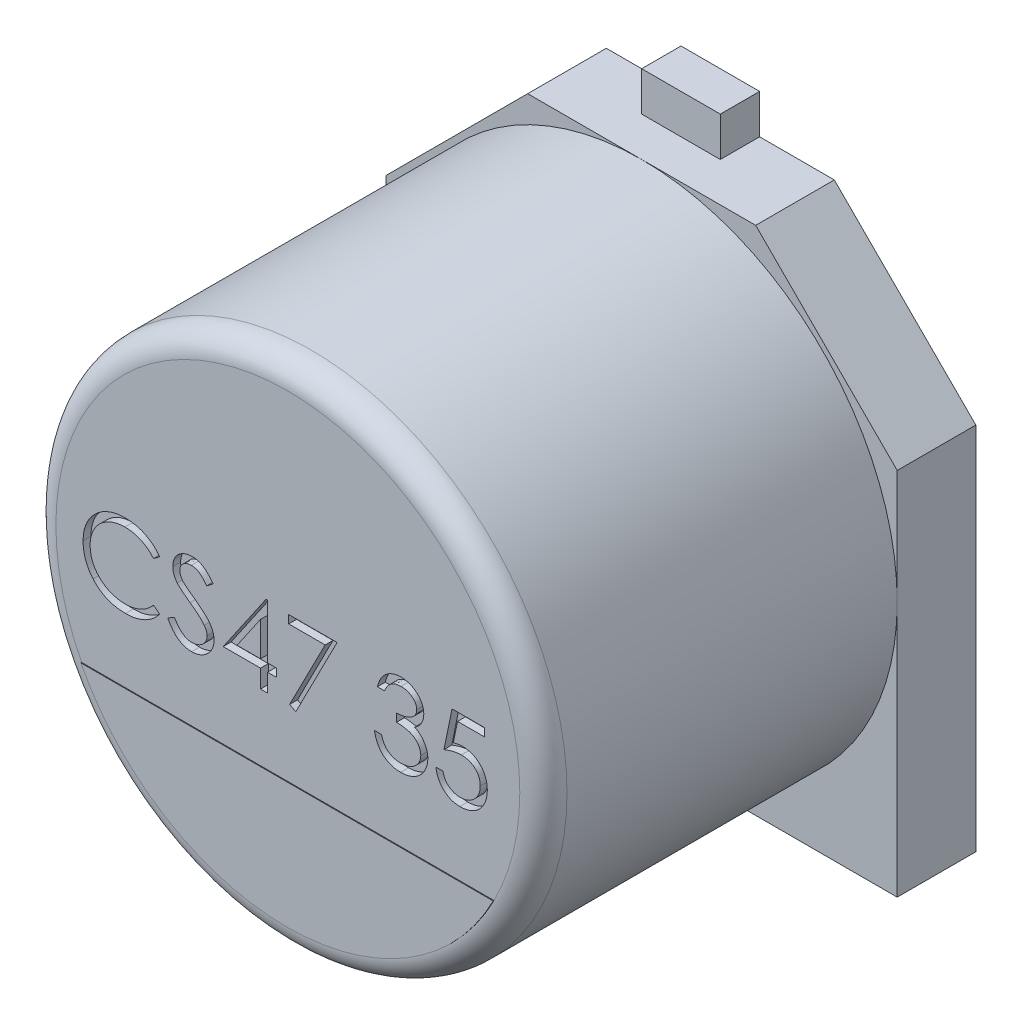
from build123d import *

# Parameters (mm, degrees)
SKETCH1_W                = 6.5
SKETCH1_H                = 6.5
BOSS_EXTRUDE1_DEPTH      = 1
SKETCH2_R                = 3.25
BOSS_EXTRUDE2_DEPTH      = 4.5
CHAMFER1_SIZE            = 1.8
FILLET1_R                = 0.3
BOSS_EXTRUDE3_DEPTH      = 0.01
BOSS_EXTRUDE4_DEPTH      = 0.5
BOSS_EXTRUDE4_DEPTH_BACK = 0.5
SKETCH4_W                = 0.5
SKETCH4_H                = 0.5
CUT_EXTRUDE1_DEPTH       = 0.1


with BuildPart() as part:
    # Sketch1 → Boss-Extrude1 (new body)
    with BuildSketch(Plane.XY):
        Rectangle(SKETCH1_W, SKETCH1_H)
    extrude(amount=BOSS_EXTRUDE1_DEPTH)

    # Sketch2 → Boss-Extrude2 (add)
    with BuildSketch(Plane.XY.offset(1)):
        Circle(SKETCH2_R)
    extrude(amount=BOSS_EXTRUDE2_DEPTH)

    # Chamfer1
    chamfer1_edges = [part.edges().sort_by_distance(p)[0] for p in [
        (-3.25, 3.25, 0.5),
        (3.25, 3.25, 0.5),
    ]]
    chamfer(chamfer1_edges, length=CHAMFER1_SIZE)

    # Fillet1
    fillet1_edges = [part.edges().sort_by_distance(p)[0] for p in [
        (-3.25, 0, 5.5),
    ]]
    fillet(fillet1_edges, radius=FILLET1_R)

    # Sketch3 → Boss-Extrude3 (add)
    with BuildSketch(Plane.XY.offset(5.5)):
        with BuildLine():
            Line((-2.622532588, -1.350860032), (2.622532588, -1.350860032))
            ThreePointArc((2.622532588, -1.350860032), (0, -2.95), (-2.622532588, -1.350860032))
        make_face()
    extrude(amount=BOSS_EXTRUDE3_DEPTH)

    # Sketch4 → Boss-Extrude4 (add, two sides: drawn at the far end of the back side and taken through both)
    with BuildSketch(Plane(origin=(0, 0, 0), x_dir=(0, 0, -1), z_dir=(1, 0, 0)).offset(-BOSS_EXTRUDE4_DEPTH_BACK)):
        with Locations((-0.25, 3.5)):
            Rectangle(SKETCH4_W, SKETCH4_H)
        with Locations((-0.25, -3.5)):
            Rectangle(SKETCH4_W, SKETCH4_H)
    extrude(amount=BOSS_EXTRUDE4_DEPTH + BOSS_EXTRUDE4_DEPTH_BACK)

    # Sketch5 → Cut-Extrude1 (cut)
    # profile 1 of 6: a face of its own
    with BuildSketch(Plane.XY.offset(5.5)):
        with BuildLine():
            Line((-1.630083449, 0.309662932), (-1.70860909, 0.249566778))
            add(Edge.make_bspline(
                [(-1.70860909, 0.249566778), (-1.714210772, 0.256242769), (-1.725338614, 0.269504745), (-1.743241244, 0.288127472), (-1.761898856, 0.30557469), (-1.781304319, 0.321929512), (-1.801806925, 0.336620017), (-1.82291001, 0.35041176), (-1.844966594, 0.362773971), (-1.87546709, 0.377763396), (-1.915366475, 0.393405154), (-1.965593572, 0.406520363), (-2.018025315, 0.414869271), (-2.053796057, 0.415773511), (-2.0719905, 0.416233444)],
                knots=[0, 0, 0, 0, 0.757959112, 1.505699292, 2.245454638, 2.979532153, 3.711538275, 4.438200793, 5.171680507, 5.909471876, 7.393775596, 8.890124382, 10.418191784, 12, 12, 12, 12], degree=3))
            add(Edge.make_bspline(
                [(-2.0719905, 0.416233444), (-2.0820143, 0.416118026), (-2.101968869, 0.415888262), (-2.131582719, 0.412857083), (-2.160643591, 0.408596738), (-2.189132581, 0.402275217), (-2.217013426, 0.39428304), (-2.244468398, 0.384732922), (-2.271099998, 0.372917253), (-2.297276638, 0.35985775), (-2.322356412, 0.345107052), (-2.346086426, 0.329017523), (-2.368380131, 0.311769209), (-2.389255163, 0.293297465), (-2.408732863, 0.273685476), (-2.426672094, 0.252724235), (-2.443010783, 0.230480757), (-2.45807279, 0.207248355), (-2.471562143, 0.1830947), (-2.482856394, 0.157930395), (-2.492857857, 0.132186365), (-2.500771927, 0.105571748), (-2.507036074, 0.078273815), (-2.511358264, 0.050219304), (-2.51435497, 0.021466824), (-2.514583592, 0.001978449), (-2.514698834, -0.007845081)],
                knots=[0, 0, 0, 0, 1.054917814, 2.100044995, 3.131103042, 4.146048494, 5.169673617, 6.183595914, 7.203665975, 8.234915748, 9.262203917, 10.264457458, 11.251630812, 12.227803204, 13.197192746, 14.159520551, 15.12972552, 16.100847026, 17.073214652, 18.039054194, 19.002613845, 19.979014051, 20.95965708, 21.949030935, 22.966165397, 24, 24, 24, 24], degree=3))
            add(Edge.make_bspline(
                [(-2.514698834, -0.007845081), (-2.514338314, -0.022625458), (-2.513630481, -0.051644768), (-2.507330957, -0.094150657), (-2.497758074, -0.13487085), (-2.483410766, -0.173550805), (-2.465719609, -0.210667478), (-2.443365149, -0.245592865), (-2.417474709, -0.278854741), (-2.387682018, -0.309667011), (-2.354994642, -0.33781379), (-2.31992381, -0.36259967), (-2.282556871, -0.383261065), (-2.243306405, -0.400454193), (-2.201870373, -0.413670401), (-2.158323286, -0.422974436), (-2.112759859, -0.429043631), (-2.081625745, -0.429624684), (-2.065780564, -0.429920402)],
                knots=[0, 0, 0, 0, 1.029171465, 2.020641659, 2.987623507, 3.938342917, 4.889210282, 5.84687017, 6.821220943, 7.821438502, 8.827599549, 9.822697543, 10.807740252, 11.797342354, 12.80366471, 13.83203677, 14.896651826, 16, 16, 16, 16], degree=3))
            add(Edge.make_bspline(
                [(-2.065780564, -0.429920402), (-2.048322653, -0.429437893), (-2.013961308, -0.428488201), (-1.963570443, -0.420442701), (-1.915331653, -0.407397582), (-1.869242343, -0.389141033), (-1.825432444, -0.365408093), (-1.783833398, -0.336637271), (-1.744410092, -0.30255489), (-1.720704011, -0.27653114), (-1.70860909, -0.263253735)],
                knots=[0, 0, 0, 0, 1.028121516, 2.023589091, 2.998037872, 3.967518031, 4.937445131, 5.927275754, 6.942489185, 8, 8, 8, 8], degree=3))
            Line((-1.70860909, -0.263253735), (-1.630083449, -0.322748927))
            add(Edge.make_bspline(
                [(-1.630083449, -0.322748927), (-1.636402909, -0.330902771), (-1.649011559, -0.347171401), (-1.669428135, -0.370106175), (-1.690935935, -0.391678757), (-1.713694709, -0.41171522), (-1.737442649, -0.430616496), (-1.762606167, -0.447845591), (-1.788854462, -0.463642986), (-1.816098599, -0.478107822), (-1.844309631, -0.490941321), (-1.873453756, -0.501928112), (-1.903405349, -0.511392366), (-1.93416578, -0.519178634), (-1.965798853, -0.525256086), (-1.998190417, -0.52931885), (-2.031410381, -0.532102254), (-2.053822216, -0.532355945), (-2.065179603, -0.532484504)],
                knots=[0, 0, 0, 0, 0.986787822, 1.968848986, 2.935600012, 3.899624008, 4.868462664, 5.837806735, 6.815139263, 7.798259679, 8.787526145, 9.778297419, 10.776456485, 11.791383307, 12.812564526, 13.85620153, 14.913611965, 16, 16, 16, 16], degree=3))
            add(Edge.make_bspline(
                [(-2.065179603, -0.532484504), (-2.075934936, -0.532409649), (-2.097202276, -0.532261633), (-2.12860192, -0.529863871), (-2.159170371, -0.526592517), (-2.188820264, -0.521666766), (-2.2177134, -0.515854097), (-2.245587853, -0.508062309), (-2.272717913, -0.499333976), (-2.298994582, -0.489075408), (-2.32444021, -0.477499356), (-2.348972728, -0.464416054), (-2.372580851, -0.449935521), (-2.395496686, -0.434376947), (-2.41738171, -0.417240575), (-2.438425574, -0.398764393), (-2.458746282, -0.379010676), (-2.471318477, -0.364766432), (-2.477639539, -0.357604697)],
                knots=[0, 0, 0, 0, 1.114604814, 2.203992996, 3.262667896, 4.300477797, 5.318619304, 6.316056647, 7.298880507, 8.271930387, 9.238335007, 10.195173496, 11.151986948, 12.108099108, 13.064862484, 14.031167946, 15.010108607, 16, 16, 16, 16], degree=3))
            add(Edge.make_bspline(
                [(-2.477639539, -0.357604697), (-2.487764008, -0.345164357), (-2.507890716, -0.320433868), (-2.533640911, -0.280352159), (-2.55568307, -0.2385041), (-2.573504762, -0.194669834), (-2.587436971, -0.148947724), (-2.597088741, -0.10131472), (-2.603360628, -0.051815308), (-2.604077853, -0.018147654), (-2.604442423, -0.001034184)],
                knots=[0, 0, 0, 0, 0.994628077, 1.977248131, 2.950237994, 3.925870899, 4.908910175, 5.911660606, 6.938484602, 8, 8, 8, 8], degree=3))
            add(Edge.make_bspline(
                [(-2.604442423, -0.001034184), (-2.603998082, 0.016953089), (-2.603123869, 0.052341924), (-2.595696499, 0.104277339), (-2.583748272, 0.154034882), (-2.566777732, 0.201521666), (-2.545261917, 0.24698746), (-2.518682885, 0.290084948), (-2.487349416, 0.331089747), (-2.451507253, 0.369379676), (-2.4122023, 0.40439092), (-2.370111211, 0.435192693), (-2.325316369, 0.460826269), (-2.278311268, 0.482253743), (-2.228743931, 0.49872359), (-2.176720111, 0.510253072), (-2.122337564, 0.517429391), (-2.085234014, 0.518336593), (-2.066381526, 0.518797547)],
                knots=[0, 0, 0, 0, 1.032925535, 2.032216505, 3.007276963, 3.968222605, 4.92396291, 5.891752235, 6.871517503, 7.883894988, 8.900124299, 9.891468569, 10.874487609, 11.85992873, 12.854644235, 13.869047385, 14.917252991, 16, 16, 16, 16], degree=3))
            add(Edge.make_bspline(
                [(-2.066381526, 0.518797547), (-2.054891677, 0.518659793), (-2.032148678, 0.518387123), (-1.998505063, 0.515728226), (-1.965750112, 0.511295767), (-1.93386126, 0.505262604), (-1.90268337, 0.497774798), (-1.872454729, 0.488020427), (-1.842997962, 0.476867132), (-1.814498845, 0.464021856), (-1.787094117, 0.449602787), (-1.760792311, 0.433769752), (-1.735802352, 0.416542379), (-1.711948395, 0.398067186), (-1.689629478, 0.377953312), (-1.668211912, 0.356753999), (-1.648423033, 0.33385862), (-1.636207834, 0.317742925), (-1.630083449, 0.309662932)],
                knots=[0, 0, 0, 0, 1.096760587, 2.17092713, 3.219439832, 4.250915756, 5.268269357, 6.278326846, 7.281116186, 8.274029601, 9.260640565, 10.235837813, 11.203064059, 12.156899882, 13.114053108, 14.069676657, 15.032185724, 16, 16, 16, 16], degree=3))
        make_face()
    # profile 2 of 6: a face of its own
    with BuildSketch(Plane.XY.offset(5.5)):
        with BuildLine():
            Line((-1.527519347, -0.313934825), (-1.44298409, -0.263253735))
            add(Edge.make_bspline(
                [(-1.44298409, -0.263253735), (-1.435121737, -0.276414988), (-1.420057771, -0.301631441), (-1.394928811, -0.335705166), (-1.368890836, -0.364665783), (-1.341751027, -0.388344813), (-1.313675042, -0.406987352), (-1.284479598, -0.42018799), (-1.25426308, -0.428421126), (-1.233699131, -0.429421151), (-1.223432808, -0.429920402)],
                knots=[0, 0, 0, 0, 1.272034388, 2.437168799, 3.508375237, 4.49857839, 5.41946034, 6.295179144, 7.148887113, 8, 8, 8, 8], degree=3))
            add(Edge.make_bspline(
                [(-1.223432808, -0.429920402), (-1.214665134, -0.42967621), (-1.197283198, -0.429192098), (-1.171693986, -0.42454044), (-1.146842043, -0.417394118), (-1.123239575, -0.407159566), (-1.101212256, -0.394777142), (-1.081896058, -0.379821091), (-1.065197168, -0.363076461), (-1.051537421, -0.344395702), (-1.041057411, -0.324305088), (-1.033002534, -0.303683388), (-1.028532513, -0.282206654), (-1.027859155, -0.267746522), (-1.027519347, -0.260449248)],
                knots=[0, 0, 0, 0, 1.095163259, 2.171163733, 3.241058638, 4.321873601, 5.38011039, 6.391990106, 7.366004449, 8.327778327, 9.272591725, 10.192022065, 11.087607919, 12, 12, 12, 12], degree=3))
            add(Edge.make_bspline(
                [(-1.027519347, -0.260449248), (-1.027940578, -0.252123291), (-1.02879688, -0.235197837), (-1.036034446, -0.210226507), (-1.047419945, -0.185514345), (-1.057923558, -0.170228269), (-1.063376718, -0.162292197)],
                knots=[0, 0, 0, 0, 0.938893495, 1.908633276, 2.914225137, 4, 4, 4, 4], degree=3))
            add(Edge.make_bspline(
                [(-1.063376718, -0.162292197), (-1.067854037, -0.156564533), (-1.077253606, -0.144540019), (-1.093412896, -0.12664138), (-1.112374643, -0.108178975), (-1.133489944, -0.088447816), (-1.157527969, -0.068365588), (-1.183735831, -0.046974651), (-1.212782648, -0.025088487), (-1.233153932, -0.010410611), (-1.24366518, -0.002837068)],
                knots=[0, 0, 0, 0, 0.722233717, 1.516239348, 2.393582979, 3.351407094, 4.387010283, 5.505090956, 6.712668013, 8, 8, 8, 8], degree=3))
            add(Edge.make_bspline(
                [(-1.24366518, -0.002837068), (-1.254186322, 0.004656814), (-1.274301943, 0.018984546), (-1.302432967, 0.040248627), (-1.327588528, 0.059689733), (-1.349656818, 0.077490879), (-1.368628132, 0.09365448), (-1.384651963, 0.10802532), (-1.397320123, 0.120992052), (-1.404364574, 0.129403864), (-1.407527359, 0.13318056)],
                knots=[0, 0, 0, 0, 1.452282411, 2.77665338, 3.964542531, 5.026858415, 5.96415736, 6.766646006, 7.446254459, 8, 8, 8, 8], degree=3))
            add(Edge.make_bspline(
                [(-1.407527359, 0.13318056), (-1.411948087, 0.13906657), (-1.42064204, 0.1506422), (-1.432118041, 0.168735016), (-1.441872088, 0.187255949), (-1.449518469, 0.206254768), (-1.455957388, 0.225464748), (-1.460288226, 0.245136532), (-1.463000053, 0.265181852), (-1.463277764, 0.278671423), (-1.463416782, 0.285424149)],
                knots=[0, 0, 0, 0, 1.068054152, 2.10047183, 3.106115577, 4.101338837, 5.06977816, 6.043150881, 7.020423561, 8, 8, 8, 8], degree=3))
            add(Edge.make_bspline(
                [(-1.463416782, 0.285424149), (-1.463043866, 0.296004085), (-1.462306003, 0.316937818), (-1.456065855, 0.347518055), (-1.446216457, 0.376714174), (-1.432417917, 0.404237127), (-1.414630102, 0.429370264), (-1.394045538, 0.452402689), (-1.369527971, 0.471765141), (-1.342627221, 0.488682872), (-1.313182543, 0.501924565), (-1.282328, 0.511913416), (-1.25001455, 0.517573204), (-1.22812794, 0.518385423), (-1.217022552, 0.518797547)],
                knots=[0, 0, 0, 0, 1.005424448, 1.989358655, 2.955360095, 3.929531133, 4.905563448, 5.876582895, 6.856512386, 7.866279853, 8.892233794, 9.918561126, 10.94386622, 12, 12, 12, 12], degree=3))
            add(Edge.make_bspline(
                [(-1.217022552, 0.518797547), (-1.205238523, 0.518391104), (-1.181803851, 0.517582818), (-1.147332647, 0.510554951), (-1.11414387, 0.498926188), (-1.087445795, 0.485729429), (-1.06655072, 0.472549024), (-1.050615654, 0.46054336), (-1.034467811, 0.446721901), (-1.017976938, 0.43104783), (-1.001422464, 0.41337733), (-0.98455862, 0.393831419), (-0.967345972, 0.372529546), (-0.956272869, 0.357322545), (-0.95059627, 0.349526714)],
                knots=[0, 0, 0, 0, 1.286793592, 2.559021753, 3.825965368, 5.121522368, 5.803751409, 6.523245864, 7.299691795, 8.125521123, 9.008227632, 9.944561021, 10.946284179, 12, 12, 12, 12], degree=3))
            Line((-0.95059627, 0.349526714), (-1.031726077, 0.288028316))
            add(Edge.make_bspline(
                [(-1.031726077, 0.288028316), (-1.036624915, 0.294339371), (-1.046058931, 0.306492986), (-1.060381642, 0.323513362), (-1.073881256, 0.339060927), (-1.08718137, 0.35256525), (-1.09957955, 0.364765859), (-1.111612991, 0.375211504), (-1.12310852, 0.384004531), (-1.137599066, 0.393388405), (-1.155804128, 0.402690264), (-1.178656853, 0.410561429), (-1.202538646, 0.415291446), (-1.218804255, 0.415916843), (-1.227038577, 0.416233444)],
                knots=[0, 0, 0, 0, 1.181633172, 2.275549214, 3.290209073, 4.226197932, 5.078386478, 5.862611352, 6.581680152, 7.217281963, 8.414376989, 9.595101626, 10.782541182, 12, 12, 12, 12], degree=3))
            add(Edge.make_bspline(
                [(-1.227038577, 0.416233444), (-1.237369012, 0.415887244), (-1.257290283, 0.41521963), (-1.285573208, 0.407928206), (-1.311028615, 0.396447674), (-1.332900776, 0.380357681), (-1.351111341, 0.36129454), (-1.364284329, 0.339357724), (-1.372212948, 0.315134181), (-1.373180456, 0.298236564), (-1.373673193, 0.28963088)],
                knots=[0, 0, 0, 0, 1.14458467, 2.207223713, 3.21896685, 4.227309161, 5.202851033, 6.127160689, 7.046193047, 8, 8, 8, 8], degree=3))
            add(Edge.make_bspline(
                [(-1.373673193, 0.28963088), (-1.373560871, 0.284273315), (-1.373336043, 0.273549424), (-1.370200387, 0.25770616), (-1.366172007, 0.24190292), (-1.359788398, 0.226210754), (-1.350975454, 0.210355223), (-1.339402547, 0.194063298), (-1.324827315, 0.177191381), (-1.313662454, 0.166217846), (-1.307767744, 0.160424149)],
                knots=[0, 0, 0, 0, 0.858281714, 1.717966888, 2.583508476, 3.4729293, 4.427298488, 5.488583878, 6.674047936, 8, 8, 8, 8], degree=3))
            add(Edge.make_bspline(
                [(-1.307767744, 0.160424149), (-1.30557878, 0.158470714), (-1.300378304, 0.153829797), (-1.290870897, 0.146232002), (-1.278315812, 0.136859782), (-1.263040897, 0.125263406), (-1.244764508, 0.111811559), (-1.223484635, 0.096676242), (-1.199438482, 0.07936611), (-1.182375078, 0.067263956), (-1.17335268, 0.060864855)],
                knots=[0, 0, 0, 0, 0.420754252, 0.999615792, 1.744751191, 2.668019286, 3.750313428, 4.999500688, 6.413464383, 8, 8, 8, 8], degree=3))
            add(Edge.make_bspline(
                [(-1.17335268, 0.060864855), (-1.162499562, 0.052967323), (-1.141484003, 0.037674849), (-1.111581837, 0.01469894), (-1.08446932, -0.007771851), (-1.060051262, -0.029594025), (-1.038086431, -0.050602051), (-1.018818511, -0.071048674), (-1.002051174, -0.090787409), (-0.983999969, -0.116093859), (-0.965554877, -0.147174169), (-0.949714447, -0.185253666), (-0.939726347, -0.223481186), (-0.9384202, -0.249174568), (-0.937775757, -0.261851492)],
                knots=[0, 0, 0, 0, 1.163667725, 2.253281268, 3.268753668, 4.215851969, 5.092017293, 5.902905408, 6.650798638, 7.335211899, 8.59617414, 9.77448103, 10.901945474, 12, 12, 12, 12], degree=3))
            add(Edge.make_bspline(
                [(-0.937775757, -0.261851492), (-0.937963511, -0.270816739), (-0.938335372, -0.288573134), (-0.942609919, -0.314646013), (-0.94887268, -0.339969119), (-0.95831189, -0.364229437), (-0.969832792, -0.387870797), (-0.98445172, -0.410273055), (-1.001396773, -0.431932026), (-1.020834992, -0.452270166), (-1.042105249, -0.470940508), (-1.064586305, -0.487548811), (-1.088314954, -0.501396903), (-1.113162473, -0.512697144), (-1.13913457, -0.521535292), (-1.166222508, -0.527938969), (-1.19447094, -0.531869172), (-1.213671077, -0.532277104), (-1.223432808, -0.532484504)],
                knots=[0, 0, 0, 0, 0.983748083, 1.948392443, 2.894712957, 3.844097841, 4.80183111, 5.778335162, 6.776009319, 7.81870978, 8.863265674, 9.881300176, 10.883814829, 11.87499822, 12.874611388, 13.892143829, 14.928324115, 16, 16, 16, 16], degree=3))
            add(Edge.make_bspline(
                [(-1.223432808, -0.532484504), (-1.230985763, -0.532338452), (-1.245996552, -0.532048188), (-1.268199261, -0.529482108), (-1.289953429, -0.525851507), (-1.310986081, -0.520087487), (-1.331568199, -0.513094065), (-1.351610266, -0.504483113), (-1.371121996, -0.494163912), (-1.390212733, -0.482365334), (-1.408833926, -0.46863455), (-1.426810917, -0.452642122), (-1.444733541, -0.434829121), (-1.462072798, -0.414711817), (-1.47917941, -0.392615222), (-1.495716099, -0.368332598), (-1.512025161, -0.341996211), (-1.522258152, -0.32346333), (-1.527519347, -0.313934825)],
                knots=[0, 0, 0, 0, 0.915332311, 1.819136955, 2.706846663, 3.586547465, 4.459518054, 5.340707479, 6.227863349, 7.133153174, 8.059268498, 9.028702269, 10.047606654, 11.120612155, 12.245963614, 13.433783089, 14.680604001, 16, 16, 16, 16], degree=3))
        make_face()
    # profile 3 of 6: a face of its own
    with BuildSketch(Plane.XY.offset(5.5)):
        Polygon((-0.276517744, 0.518797547), (-0.258288577, 0.518797547), (-0.258288577, -0.173510145), (-0.142903962, -0.173510145), (-0.142903962, -0.276074248), (-0.258288577, -0.276074248), (-0.258288577, -0.506843479), (-0.348032167, -0.506843479), (-0.348032167, -0.276074248), (-0.822391141, -0.276074248), align=None)
        Polygon((-0.348032167, -0.173510145), (-0.348032167, 0.260784726), (-0.64610909, -0.173510145), align=None, mode=Mode.SUBTRACT)
    # profile 4 of 6: a face of its own
    with BuildSketch(Plane.XY.offset(5.5)):
        Polygon((0.010942192, 0.493156521), (0.626326807, 0.493156521), (0.100685782, -0.532484504), (0.023161743, -0.489816235), (0.474483859, 0.390592419), (0.010942192, 0.390592419), align=None)
    # profile 5 of 6: a face of its own
    with BuildSketch(Plane.XY.offset(5.5)):
        with BuildLine():
            Line((1.22889091, 0.262387291), (1.13914732, 0.262387291))
            add(Edge.make_bspline(
                [(1.13914732, 0.262387291), (1.14157862, 0.272453714), (1.146331613, 0.29213275), (1.156245206, 0.32024911), (1.167044993, 0.346855831), (1.180013309, 0.371454709), (1.194158667, 0.39454011), (1.210365159, 0.415588431), (1.22788508, 0.435134992), (1.247263636, 0.452481632), (1.267586111, 0.468189554), (1.28913886, 0.481582428), (1.311488258, 0.493103614), (1.334789153, 0.502595109), (1.359110916, 0.509745259), (1.384233666, 0.514932918), (1.410223237, 0.518301807), (1.427865406, 0.518630597), (1.436823602, 0.518797547)],
                knots=[0, 0, 0, 0, 1.162005537, 2.271625781, 3.343758855, 4.383309926, 5.390229558, 6.379919256, 7.361854164, 8.333198761, 9.295911338, 10.242430842, 11.177959212, 12.116337295, 13.062827104, 14.020064771, 14.994644689, 16, 16, 16, 16], degree=3))
            add(Edge.make_bspline(
                [(1.436823602, 0.518797547), (1.449875814, 0.518403481), (1.475695532, 0.517623945), (1.513627831, 0.510505535), (1.550206922, 0.499241211), (1.585032421, 0.483677289), (1.617380545, 0.464480914), (1.646162313, 0.441633846), (1.670987601, 0.415576903), (1.691814566, 0.38679617), (1.708121709, 0.356037454), (1.720146387, 0.324380266), (1.727466867, 0.291899702), (1.728415598, 0.269969051), (1.72889091, 0.258981842)],
                knots=[0, 0, 0, 0, 1.083050992, 2.142477498, 3.193116406, 4.255571735, 5.30263384, 6.308962982, 7.297363603, 8.282367274, 9.249857812, 10.179914175, 11.08814088, 12, 12, 12, 12], degree=3))
            add(Edge.make_bspline(
                [(1.72889091, 0.258981842), (1.728558455, 0.248408472), (1.727907893, 0.227718028), (1.722383977, 0.197511886), (1.713087902, 0.169042857), (1.700210827, 0.142191096), (1.683541813, 0.117126856), (1.663349614, 0.093793745), (1.63949171, 0.072088271), (1.621412014, 0.059654136), (1.612104051, 0.053252675)],
                knots=[0, 0, 0, 0, 1.024540389, 2.004866551, 2.965041327, 3.920577974, 4.882998113, 5.874504559, 6.905732034, 8, 8, 8, 8], degree=3))
            add(Edge.make_bspline(
                [(1.612104051, 0.053252675), (1.622741695, 0.048116055), (1.643817945, 0.037938924), (1.672546668, 0.017980136), (1.698626061, -0.005064535), (1.71316998, -0.02304815), (1.720477448, -0.032083863)],
                knots=[0, 0, 0, 0, 1.015518401, 2.012035669, 3.001164323, 4, 4, 4, 4], degree=3))
            add(Edge.make_bspline(
                [(1.720477448, -0.032083863), (1.72528926, -0.038671792), (1.734834088, -0.051739769), (1.746615669, -0.072750176), (1.757303987, -0.093993459), (1.765632621, -0.116039003), (1.772082298, -0.138631293), (1.776692593, -0.16180912), (1.779556633, -0.185591412), (1.779966791, -0.201680692), (1.780172961, -0.209768158)],
                knots=[0, 0, 0, 0, 1.025084078, 2.033381695, 3.024893161, 4.013698104, 4.991890475, 5.976764909, 6.982997093, 8, 8, 8, 8], degree=3))
            add(Edge.make_bspline(
                [(1.780172961, -0.209768158), (1.779660243, -0.223770936), (1.77863722, -0.251710593), (1.769493198, -0.292989085), (1.755317987, -0.333339229), (1.735187434, -0.37193204), (1.71065386, -0.40804072), (1.681466053, -0.440348237), (1.64795565, -0.468119267), (1.610582608, -0.491322189), (1.570092, -0.509870167), (1.526784688, -0.522743722), (1.481284672, -0.531128293), (1.450082587, -0.532027399), (1.434219436, -0.532484504)],
                knots=[0, 0, 0, 0, 0.955779014, 1.907060117, 2.875433937, 3.871313158, 4.872415639, 5.851225146, 6.836215519, 7.83643374, 8.849228613, 9.86973379, 10.916971861, 12, 12, 12, 12], degree=3))
            add(Edge.make_bspline(
                [(1.434219436, -0.532484504), (1.423528207, -0.532236443), (1.402491434, -0.531748342), (1.37156472, -0.528411599), (1.342044235, -0.522317312), (1.313890064, -0.514116367), (1.287077196, -0.503718727), (1.261687452, -0.490770527), (1.237564625, -0.47553867), (1.214936353, -0.457843359), (1.193805334, -0.43804869), (1.174733127, -0.415803259), (1.157401758, -0.391518286), (1.14227529, -0.364911699), (1.128664732, -0.33632734), (1.117470173, -0.305399197), (1.107617153, -0.272403762), (1.103036163, -0.249410122), (1.100685782, -0.237612709)],
                knots=[0, 0, 0, 0, 1.048658725, 2.063410685, 3.046034179, 4.001477787, 4.936774919, 5.862367409, 6.792675028, 7.730719943, 8.675894397, 9.627829632, 10.600096036, 11.597688215, 12.626045268, 13.701542398, 14.82072376, 16, 16, 16, 16], degree=3))
            Line((1.100685782, -0.237612709), (1.190429371, -0.237612709))
            add(Edge.make_bspline(
                [(1.190429371, -0.237612709), (1.192767455, -0.245312428), (1.19731523, -0.260289048), (1.205056458, -0.281843421), (1.213875964, -0.301602865), (1.223337267, -0.319712328), (1.233273965, -0.336350158), (1.244392515, -0.351076406), (1.255869414, -0.364537892), (1.264520658, -0.372122067), (1.268754692, -0.375833863)],
                knots=[0, 0, 0, 0, 1.198163088, 2.33053128, 3.407730985, 4.417276592, 5.372219308, 6.28897303, 7.162600585, 8, 8, 8, 8], degree=3))
            add(Edge.make_bspline(
                [(1.268754692, -0.375833863), (1.274353714, -0.38015053), (1.285534475, -0.388770539), (1.303753969, -0.399771005), (1.322915365, -0.409302726), (1.343433844, -0.416583782), (1.364866635, -0.422748828), (1.387560168, -0.426783262), (1.41131423, -0.429551311), (1.427533591, -0.429795577), (1.435822, -0.429920402)],
                knots=[0, 0, 0, 0, 0.946170439, 1.889420265, 2.845303464, 3.807233317, 4.801018734, 5.828864929, 6.890507805, 8, 8, 8, 8], degree=3))
            add(Edge.make_bspline(
                [(1.435822, -0.429920402), (1.445180143, -0.429744429), (1.463479185, -0.429400329), (1.490180574, -0.426235841), (1.515582702, -0.421627152), (1.539403537, -0.414509157), (1.561955111, -0.405714628), (1.582921297, -0.394672226), (1.602577327, -0.381716591), (1.620671443, -0.366991117), (1.636941588, -0.35087069), (1.651267163, -0.334009813), (1.663445638, -0.316479576), (1.673269517, -0.29818297), (1.681026817, -0.279195762), (1.686307732, -0.259464668), (1.689979593, -0.239151163), (1.690278625, -0.225342886), (1.690429371, -0.21838194)],
                knots=[0, 0, 0, 0, 1.217147791, 2.380027433, 3.494444702, 4.572153297, 5.609568379, 6.639424714, 7.649109417, 8.668170816, 9.669597737, 10.625200337, 11.543417969, 12.441394052, 13.322311151, 14.205496177, 15.095365482, 16, 16, 16, 16], degree=3))
            add(Edge.make_bspline(
                [(1.690429371, -0.21838194), (1.689992142, -0.209064415), (1.68911986, -0.190475727), (1.682460266, -0.163127848), (1.671506305, -0.136778302), (1.656171301, -0.111876648), (1.63750395, -0.088797819), (1.615685406, -0.068205967), (1.590534483, -0.051214512), (1.567385949, -0.039474896), (1.546881619, -0.031464303), (1.529334366, -0.026128599), (1.509689622, -0.021610411), (1.488184951, -0.017406905), (1.464658318, -0.013829377), (1.439135336, -0.010846001), (1.411610832, -0.008458847), (1.392556213, -0.00739282), (1.382737064, -0.006843479)],
                knots=[0, 0, 0, 0, 1.07054697, 2.135767047, 3.216561865, 4.33974944, 5.486079747, 6.621378074, 7.775625952, 8.963672916, 9.598146892, 10.304877434, 11.070270905, 11.915000392, 12.823868403, 13.805723172, 14.86925407, 16, 16, 16, 16], degree=3))
            Line((1.382737064, -0.006843479), (1.382737064, 0.095720624))
            add(Edge.make_bspline(
                [(1.382737064, 0.095720624), (1.395108825, 0.095930568), (1.419342067, 0.096341796), (1.45474044, 0.101315514), (1.488589958, 0.108195693), (1.520140456, 0.118734319), (1.548897231, 0.130974404), (1.573845689, 0.145217893), (1.594636302, 0.161050678), (1.611168037, 0.178717138), (1.623604959, 0.197664294), (1.63269833, 0.217411911), (1.638069852, 0.238133071), (1.638786899, 0.252274405), (1.63914732, 0.259382483)],
                knots=[0, 0, 0, 0, 1.321986639, 2.589447074, 3.816329219, 5.01088745, 6.139805852, 7.153945165, 8.075214402, 8.924034688, 9.728124013, 10.488707548, 11.240355623, 12, 12, 12, 12], degree=3))
            add(Edge.make_bspline(
                [(1.63914732, 0.259382483), (1.639028917, 0.264604696), (1.63879336, 0.274994041), (1.635822709, 0.290172632), (1.631358697, 0.304887188), (1.625221632, 0.319075133), (1.617007289, 0.332638069), (1.607177007, 0.345691626), (1.595471836, 0.358161277), (1.582058851, 0.369784225), (1.567655478, 0.38086115), (1.551869828, 0.390265046), (1.535177864, 0.398306493), (1.517561105, 0.404937779), (1.498962382, 0.409926147), (1.47946908, 0.413507816), (1.459044028, 0.415747146), (1.445109247, 0.416069551), (1.438025525, 0.416233444)],
                knots=[0, 0, 0, 0, 0.884392785, 1.759457502, 2.611959086, 3.489218968, 4.37281399, 5.2945488, 6.255912374, 7.266815255, 8.301784654, 9.332968512, 10.37626691, 11.440494194, 12.520033166, 13.637162961, 14.798855837, 16, 16, 16, 16], degree=3))
            add(Edge.make_bspline(
                [(1.438025525, 0.416233444), (1.426639334, 0.415835912), (1.404399455, 0.41505944), (1.372338051, 0.408258579), (1.342532527, 0.397407698), (1.31975005, 0.384455407), (1.302926458, 0.371669568), (1.290904476, 0.360503172), (1.279098615, 0.348093794), (1.268285565, 0.333677115), (1.257350143, 0.318229461), (1.247394554, 0.300965552), (1.237720356, 0.282335725), (1.231891056, 0.269165544), (1.22889091, 0.262387291)],
                knots=[0, 0, 0, 0, 1.472543308, 2.876219568, 4.221790263, 5.565193594, 6.249813518, 6.953379497, 7.687249741, 8.463570142, 9.283606569, 10.136032583, 11.040678096, 12, 12, 12, 12], degree=3))
        make_face()
    # profile 6 of 6: a face of its own
    with BuildSketch(Plane.XY.offset(5.5)):
        with BuildLine():
            Line((2.498121679, 0.493156521), (2.498121679, 0.390592419))
            Line((2.498121679, 0.390592419), (2.157977448, 0.390592419))
            Line((2.157977448, 0.390592419), (2.10409123, 0.127571585))
            add(Edge.make_bspline(
                [(2.10409123, 0.127571585), (2.114678623, 0.13049452), (2.135190022, 0.136157244), (2.165464268, 0.142444607), (2.194204897, 0.146234734), (2.212855003, 0.146752251), (2.221879692, 0.147002675)],
                knots=[0, 0, 0, 0, 1.100273476, 2.13160584, 3.095893838, 4, 4, 4, 4], degree=3))
            add(Edge.make_bspline(
                [(2.221879692, 0.147002675), (2.233046475, 0.146760979), (2.25500316, 0.146285745), (2.287128573, 0.141722359), (2.317795114, 0.134539526), (2.346938648, 0.124505092), (2.374613091, 0.111673739), (2.400563823, 0.095645185), (2.42518037, 0.076921376), (2.448021111, 0.05539423), (2.468742342, 0.031702339), (2.486961196, 0.006228662), (2.502436222, -0.020779242), (2.514882152, -0.049579416), (2.524820533, -0.07985346), (2.531435389, -0.111919912), (2.535840163, -0.145476517), (2.536332273, -0.16842068), (2.536583218, -0.180120722)],
                knots=[0, 0, 0, 0, 1.052922333, 2.070308379, 3.05430497, 4.020497103, 4.973039431, 5.925935799, 6.892292201, 7.88610001, 8.88166317, 9.857072816, 10.836096531, 11.812156883, 12.81219415, 13.836441305, 14.89672472, 16, 16, 16, 16], degree=3))
            add(Edge.make_bspline(
                [(2.536583218, -0.180120722), (2.536393196, -0.188269928), (2.536015721, -0.20445821), (2.534096125, -0.22849941), (2.530400206, -0.252031649), (2.525437999, -0.275058046), (2.518997308, -0.29753501), (2.511200435, -0.319526875), (2.501658713, -0.340896762), (2.491192606, -0.361846875), (2.479407898, -0.381903592), (2.466328325, -0.400660445), (2.452509613, -0.418398811), (2.437640645, -0.434928449), (2.421583218, -0.45014074), (2.404531799, -0.464125963), (2.386622451, -0.477120629), (2.367578096, -0.488597256), (2.347823101, -0.499158101), (2.327072182, -0.507821969), (2.305797696, -0.515567834), (2.283693446, -0.521741985), (2.260809499, -0.526579857), (2.237108135, -0.529865743), (2.212713658, -0.532259011), (2.19617794, -0.532408827), (2.187825205, -0.532484504)],
                knots=[0, 0, 0, 0, 1.056347294, 2.098418968, 3.122841568, 4.141288669, 5.149314143, 6.15115421, 7.162517403, 8.180376062, 9.185164535, 10.17417709, 11.141909838, 12.097768115, 13.052685741, 14.0056014, 14.954263652, 15.917497458, 16.885230207, 17.854509472, 18.828990115, 19.81800267, 20.826176721, 21.857883937, 22.917946725, 24, 24, 24, 24], degree=3))
            add(Edge.make_bspline(
                [(2.187825205, -0.532484504), (2.177861153, -0.532287122), (2.158258059, -0.531898796), (2.129537897, -0.527836371), (2.101905152, -0.52201811), (2.075582266, -0.51326489), (2.050333334, -0.502297091), (2.026498271, -0.488435328), (2.00346805, -0.472727012), (1.982178896, -0.454189769), (1.962420007, -0.433928145), (1.944732433, -0.411940248), (1.928979982, -0.388588979), (1.915414912, -0.363760935), (1.903844048, -0.337521354), (1.894754052, -0.309771926), (1.887417379, -0.280657639), (1.884313545, -0.260613779), (1.882737064, -0.250433222)],
                knots=[0, 0, 0, 0, 1.0467383, 2.05933395, 3.04377827, 4.011590433, 4.970194871, 5.932262533, 6.905835911, 7.896367577, 8.894135286, 9.877477877, 10.858688626, 11.851381753, 12.8477658, 13.868841284, 14.917554742, 16, 16, 16, 16], degree=3))
            Line((1.882737064, -0.250433222), (1.972480653, -0.250433222))
            add(Edge.make_bspline(
                [(1.972480653, -0.250433222), (1.974688813, -0.259969352), (1.978933017, -0.278298322), (1.988248946, -0.304050133), (1.999639196, -0.326998483), (2.013183295, -0.347446935), (2.029340447, -0.365278077), (2.047777427, -0.381168667), (2.068448205, -0.395504418), (2.091417699, -0.40745378), (2.115650007, -0.417644852), (2.141012067, -0.424431051), (2.166813309, -0.429202734), (2.184264272, -0.42968038), (2.193033538, -0.429920402)],
                knots=[0, 0, 0, 0, 1.136247022, 2.183929868, 3.172523383, 4.106158343, 5.02341133, 5.958108904, 6.928429099, 7.938127109, 8.96079061, 9.975095812, 10.982467395, 12, 12, 12, 12], degree=3))
            add(Edge.make_bspline(
                [(2.193033538, -0.429920402), (2.201593094, -0.429685894), (2.218446929, -0.429224146), (2.243250182, -0.425670142), (2.267196717, -0.42019655), (2.290050248, -0.412005163), (2.312210688, -0.402049529), (2.333117479, -0.389273794), (2.353375444, -0.374570931), (2.372354911, -0.35772618), (2.389737611, -0.33916341), (2.405096502, -0.319312726), (2.417889906, -0.298136484), (2.42867108, -0.276001298), (2.436857737, -0.252664567), (2.442698017, -0.22823566), (2.446127463, -0.202654237), (2.446599229, -0.185205863), (2.446839628, -0.176314633)],
                knots=[0, 0, 0, 0, 1.027316725, 2.022795036, 3.002884548, 3.971462791, 4.93288096, 5.914575861, 6.907176829, 7.935150275, 8.956128384, 9.956726525, 10.942570165, 11.921478529, 12.907843606, 13.90538589, 14.932640048, 16, 16, 16, 16], degree=3))
            add(Edge.make_bspline(
                [(2.446839628, -0.176314633), (2.446651491, -0.168292989), (2.446283239, -0.152591764), (2.443274505, -0.129620562), (2.438041084, -0.107885407), (2.430777119, -0.08728134), (2.421554402, -0.067788928), (2.410284027, -0.049388054), (2.396754485, -0.032321244), (2.38129966, -0.016580515), (2.364368791, -0.002053408), (2.345670579, 0.010330617), (2.325596314, 0.020748879), (2.304387857, 0.029739736), (2.281540743, 0.036197092), (2.257507419, 0.041045059), (2.23202836, 0.043849448), (2.214608163, 0.044238559), (2.20565373, 0.044438573)],
                knots=[0, 0, 0, 0, 1.045622112, 2.046656509, 3.013763289, 3.955457236, 4.890082067, 5.820317437, 6.762574623, 7.722996705, 8.69280354, 9.665887285, 10.63943826, 11.638615906, 12.663482002, 13.728887084, 14.832589034, 16, 16, 16, 16], degree=3))
            add(Edge.make_bspline(
                [(2.20565373, 0.044438573), (2.197902608, 0.044272689), (2.181898506, 0.043930183), (2.157349127, 0.041408326), (2.131551492, 0.037339957), (2.104604493, 0.031743886), (2.076427205, 0.024420721), (2.047079091, 0.015645149), (2.016498443, 0.00515315), (1.995893379, -0.00277034), (1.985301166, -0.006843479)],
                knots=[0, 0, 0, 0, 0.817624296, 1.688186739, 2.600797293, 3.572016777, 4.590301741, 5.671205678, 6.80286297, 8, 8, 8, 8], degree=3))
            Line((1.985301166, -0.006843479), (2.087865269, 0.493156521))
            Line((2.087865269, 0.493156521), (2.498121679, 0.493156521))
        make_face()
    extrude(amount=-CUT_EXTRUDE1_DEPTH, mode=Mode.SUBTRACT)


solid = part.part
